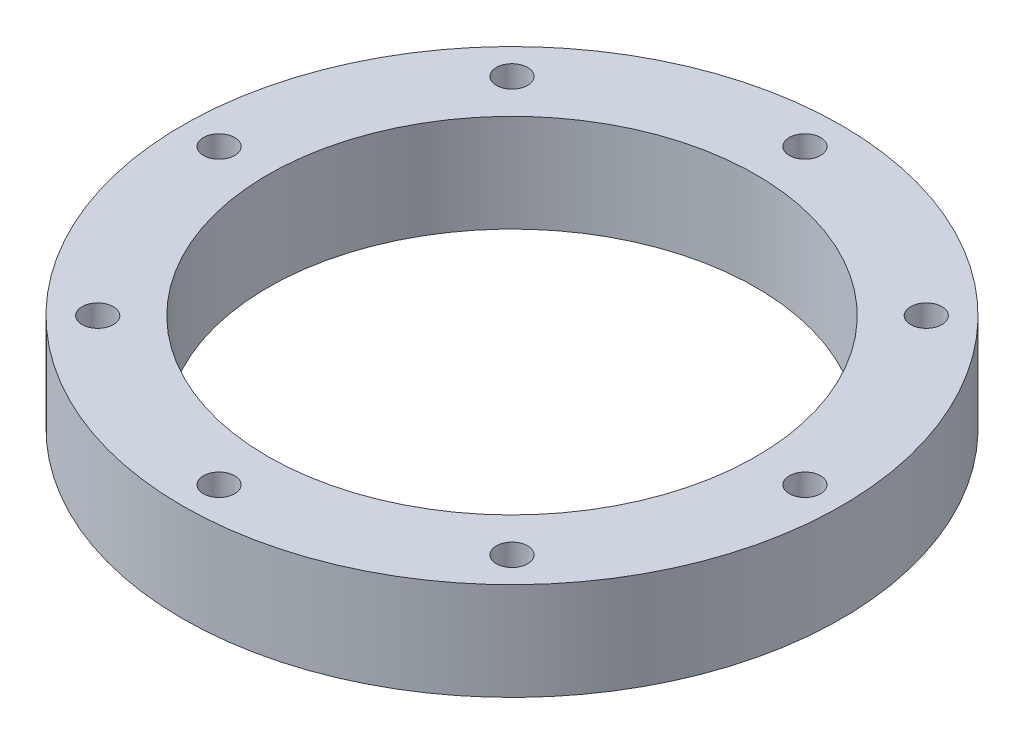
from build123d import *

# Parameters (mm, degrees)
SKETCH_1_R          = 67.5
SKETCH_1_R_2        = 50
EXTRUDE_1_DEPTH     = 20
SKETCH_2_R          = 3.2
CUT_EXTRUDE_1_DEPTH = 20


with BuildPart() as part:
    # 草图1 → 凸台-拉伸1 (new body)
    with BuildSketch(Plane(origin=(0, 0, 0), x_dir=(1, 0, 0), z_dir=(0, 1, 0))):
        with Locations(Location((0, 0, 0), (0, 0, 270))):
            Circle(SKETCH_1_R)
        with Locations(Location((0, 0, 0), (0, 0, 270))):
            Circle(SKETCH_1_R_2, mode=Mode.SUBTRACT)
    extrude(amount=EXTRUDE_1_DEPTH)

    # 草图2 → 切除-拉伸1 (cut)
    with BuildSketch(Plane(origin=(0, 20, 0), x_dir=(1, 0, 0), z_dir=(0, 1, 0))):
        with Locations(Location((0, 60, 0), (0, 0, 270))):
            Circle(SKETCH_2_R)
        with Locations(Location((42.426406871, 42.426406871, 0), (0, 0, 270))):
            Circle(SKETCH_2_R)
        with Locations(Location((60, 0, 0), (0, 0, 270))):
            Circle(SKETCH_2_R)
        with Locations(Location((42.426406871, -42.426406871, 0), (0, 0, 270))):
            Circle(SKETCH_2_R)
        with Locations(Location((0, -60, 0), (0, 0, 270))):
            Circle(SKETCH_2_R)
        with Locations(Location((-42.426406871, -42.426406871, 0), (0, 0, 270))):
            Circle(SKETCH_2_R)
        with Locations(Location((-60, 0, 0), (0, 0, 270))):
            Circle(SKETCH_2_R)
        with Locations(Location((-42.426406871, 42.426406871, 0), (0, 0, 270))):
            Circle(SKETCH_2_R)
    extrude(amount=-CUT_EXTRUDE_1_DEPTH, mode=Mode.SUBTRACT)


solid = part.part
